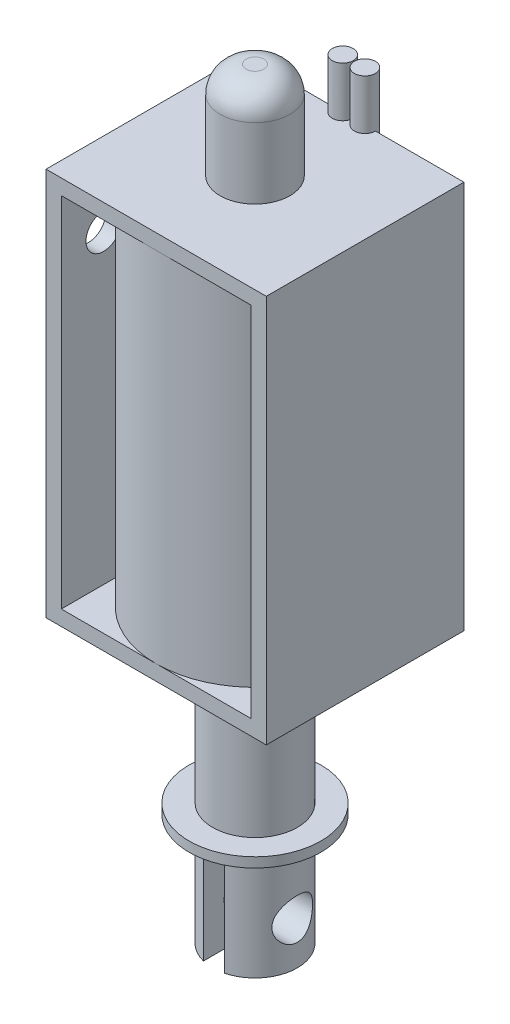
from build123d import *

# Parameters (mm, degrees)
SKETCH1_W               = 16.89
SKETCH1_H               = 15.16
BOSS_EXTRUDE1_DEPTH     = 29.8
CUT_EXTRUDE1_DEPTH      = 35.484541827
CUT_EXTRUDE1_DEPTH_BACK = 35.484541827
SKETCH2_W               = 14.55
SKETCH2_H               = 27.46
SKETCH3_R               = 3.25
BOSS_EXTRUDE2_DEPTH     = 21.2
CUT_EXTRUDE2_DEPTH      = 53.247243229
CUT_EXTRUDE2_DEPTH_BACK = 7.51
CUT_EXTRUDE3_DEPTH      = 32.887527734
CUT_EXTRUDE3_DEPTH_BACK = 32.887527734
SKETCH5_R               = 1.56
SKETCH6_R               = 2.675
BOSS_EXTRUDE3_DEPTH     = 7.41
FILLET1_R               = 2
SKETCH7_R               = 7.58
BOSS_EXTRUDE4_DEPTH     = 27.46
SKETCH8_R               = 0.805
BOSS_EXTRUDE7_DEPTH     = 5
FILLET2_R               = 0.5
CUT_EXTRUDE4_DEPTH      = 42.715278137
CUT_EXTRUDE4_DEPTH_BACK = 1.17
SKETCH9_R               = 1.35
BOSS_EXTRUDE8_START     = -8.58
SKETCH10_R              = 5.055
BOSS_EXTRUDE8_DEPTH     = 0.75


with BuildPart() as part:
    # Sketch1 → Boss-Extrude1 (new body)
    with BuildSketch(Plane(origin=(0, 0, 0), x_dir=(1, 0, 0), z_dir=(0, 1, 0))):
        Rectangle(SKETCH1_W, SKETCH1_H)
    extrude(amount=BOSS_EXTRUDE1_DEPTH)

    # Sketch2 → Cut-Extrude1 (cut, two sides: drawn at the far end of the back side and taken through both)
    with BuildSketch(Plane(origin=(0, 0, -7.58), x_dir=(-1, 0, 0), z_dir=(0, 0, -1)).offset(-CUT_EXTRUDE1_DEPTH_BACK)):
        with Locations((0, 14.9)):
            Rectangle(SKETCH2_W, SKETCH2_H)
    extrude(amount=CUT_EXTRUDE1_DEPTH + CUT_EXTRUDE1_DEPTH_BACK, mode=Mode.SUBTRACT)

    # Sketch3 → Boss-Extrude2 (add)
    with BuildSketch(Plane.XZ):
        with Locations(Location((0, 0, 0), (0, 0, 270))):
            Circle(SKETCH3_R)
    extrude(amount=BOSS_EXTRUDE2_DEPTH)

    # Sketch4 → Cut-Extrude2 (cut, two sides: drawn at the far end of the back side and taken through both)
    with BuildSketch(Plane.XZ.offset(21.2).offset(-CUT_EXTRUDE2_DEPTH_BACK)):
        with BuildLine():
            Line((-0.810006774, 3.147441664), (-0.810006774, -3.147441664))
            ThreePointArc((-0.810006774, -3.147441664), (-6.995e-06, -3.25), (0.809993226, -3.14744515))
            Line((0.809993226, -3.14744515), (0.809993226, 3.14744515))
            ThreePointArc((0.809993226, 3.14744515), (-6.995e-06, 3.25), (-0.810006774, 3.147441664))
        make_face()
    extrude(amount=CUT_EXTRUDE2_DEPTH + CUT_EXTRUDE2_DEPTH_BACK, mode=Mode.SUBTRACT)

    # Sketch5 → Cut-Extrude3 (cut, two sides: drawn at the far end of the back side and taken through both)
    with BuildSketch(Plane(origin=(0, 0, 0), x_dir=(0, 0, -1), z_dir=(1, 0, 0)).offset(-CUT_EXTRUDE3_DEPTH_BACK)):
        with Locations((0, -17.94)):
            Circle(SKETCH5_R)
    extrude(amount=CUT_EXTRUDE3_DEPTH + CUT_EXTRUDE3_DEPTH_BACK, mode=Mode.SUBTRACT)

    # Sketch6 → Boss-Extrude3 (add)
    with BuildSketch(Plane(origin=(0, 29.8, 0), x_dir=(1, 0, 0), z_dir=(0, 1, 0))):
        with Locations(Location((0, 0, 0), (0, 0, 270))):
            Circle(SKETCH6_R)
    extrude(amount=BOSS_EXTRUDE3_DEPTH)

    # Fillet1
    fillet1_edges = [part.edges().sort_by_distance(p)[0] for p in [
        (0, 37.21, -2.675),
    ]]
    fillet(fillet1_edges, radius=FILLET1_R)

    # Sketch7 → Boss-Extrude4 (add)
    with BuildSketch(Plane(origin=(0, 1.17, 0), x_dir=(1, 0, 0), z_dir=(0, 1, 0))):
        Circle(SKETCH7_R)
    extrude(amount=BOSS_EXTRUDE4_DEPTH)

    # Sketch8 → Boss-Extrude7 (add)
    with BuildSketch(Plane.XZ.offset(-28.63)):
        with Locations(Location((-0.85, -7.58, 0), (0, 0, 270))):
            Circle(SKETCH8_R)
        with Locations(Location((0.85, -7.58, 0), (0, 0, 270))):
            Circle(SKETCH8_R)
    extrude(amount=-BOSS_EXTRUDE7_DEPTH)

    # Fillet2
    fillet2_edges = [part.edges().sort_by_distance(p)[0] for p in [
        (-0.280779041, 28.63, -8.149220959),
        (-1.419220959, 28.63, -8.149220959),
        (0.280779041, 28.63, -8.149220959),
        (1.419220959, 28.63, -8.149220959),
    ]]
    fillet(fillet2_edges, radius=FILLET2_R)

    # Sketch9 → Cut-Extrude4 (cut, two sides: drawn at the far end of the back side and taken through both)
    with BuildSketch(Plane.ZY.offset(8.445).offset(-CUT_EXTRUDE4_DEPTH_BACK)):
        with Locations((4.34, 24.65)):
            Circle(SKETCH9_R)
        with Locations((-4.34, 5.02)):
            Circle(SKETCH9_R)
    extrude(amount=CUT_EXTRUDE4_DEPTH + CUT_EXTRUDE4_DEPTH_BACK, mode=Mode.SUBTRACT)

    # Sketch10 → Boss-Extrude8 (add)
    with BuildSketch(Plane.XZ.offset(21.2).offset(BOSS_EXTRUDE8_START)):
        with Locations(Location((0, 0, 0), (0, 0, 270))):
            Circle(SKETCH10_R)
    extrude(amount=-BOSS_EXTRUDE8_DEPTH)


solid = part.part
